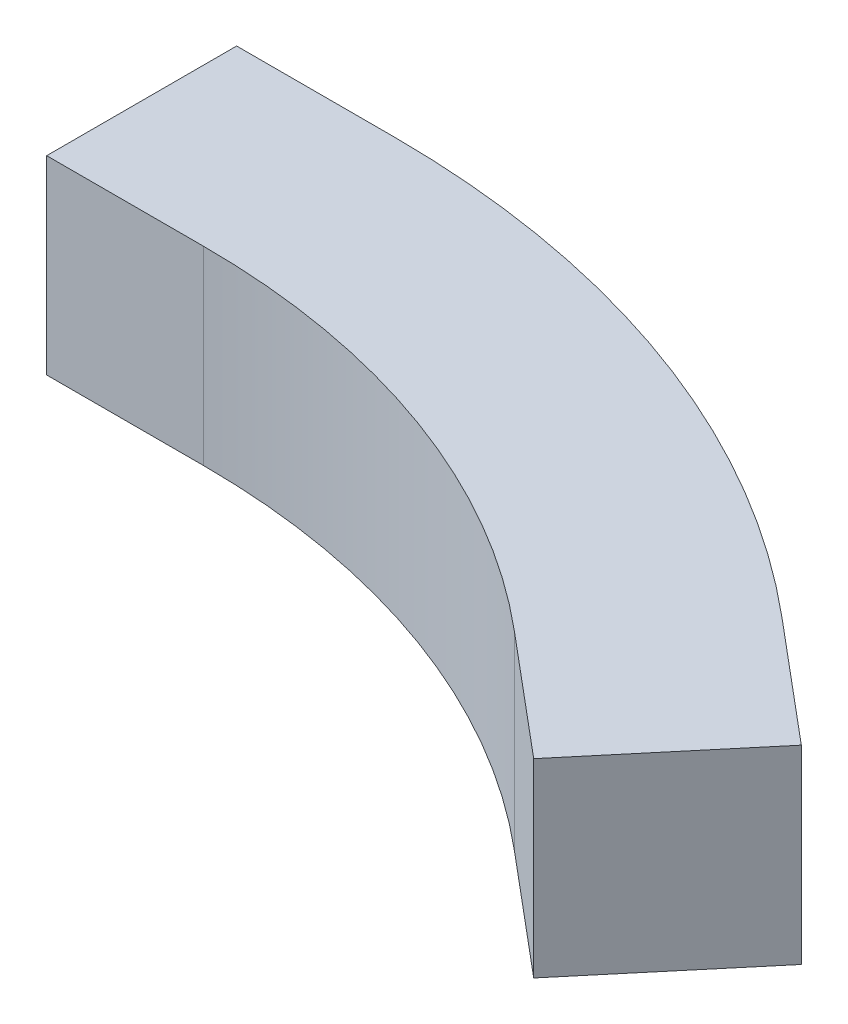
from build123d import *

# Parameters (mm, degrees)
BOSS_EXTRUDE1_DEPTH = 15


with BuildPart() as part:
    # Sketch1 → Boss-Extrude1 (new body)
    with BuildSketch(Plane(origin=(0, 0, 0), x_dir=(1, 0, 0), z_dir=(0, 1, 0))):
        with BuildLine():
            Line((0, 75), (0, 60))
            ThreePointArc((0, 60), (20.5212086, 56.381557247), (38.567256581, 45.962666587))
            Line((38.567256581, 45.962666587), (48.209070726, 57.453333234))
            ThreePointArc((48.209070726, 57.453333234), (25.651510749, 70.476946559), (0, 75))
        make_face()
        with BuildLine():
            Line((48.209070726, 57.453333234), (38.567256581, 45.962666587))
            Line((38.567256581, 45.962666587), (48.066207676, 37.992100227))
            Line((48.066207676, 37.992100227), (57.044556278, 48.692079429))
            ThreePointArc((57.044556278, 48.692079429), (52.808819258, 53.256254173), (48.209070726, 57.453333234))
        make_face()
        with BuildLine():
            Line((57.708021821, 49.482766874), (48.209070726, 57.453333234))
            ThreePointArc((48.209070726, 57.453333234), (52.808819258, 53.256254173), (57.044556278, 48.692079429))
            Line((57.044556278, 48.692079429), (57.708021821, 49.482766874))
        make_face()
        with BuildLine():
            ThreePointArc((-12.4, 73.967830846), (-6.22144222, 74.741512272), (0, 75))
            Line((0, 75), (-12.4, 75))
            Line((-12.4, 75), (-12.4, 73.967830846))
        make_face()
        with BuildLine():
            Line((-12.4, 60), (0, 60))
            Line((0, 60), (0, 75))
            ThreePointArc((0, 75), (-6.22144222, 74.741512272), (-12.4, 73.967830846))
            Line((-12.4, 73.967830846), (-12.4, 60))
        make_face()
    extrude(amount=BOSS_EXTRUDE1_DEPTH)


solid = part.part
